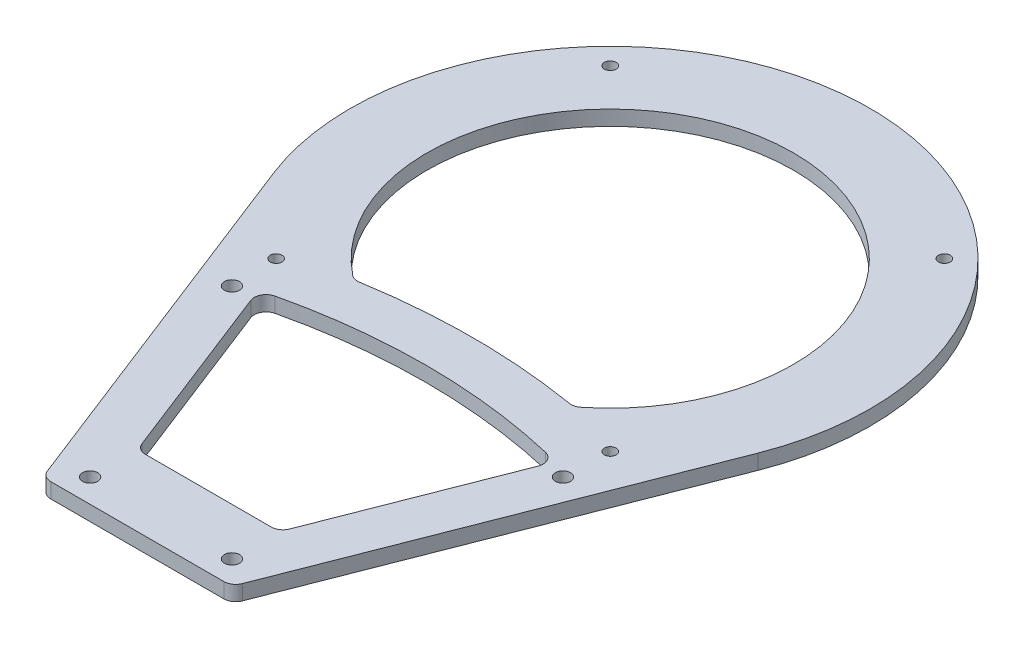
from build123d import *

# Parameters (mm, degrees)
BOSS_EXTRUDE1_DEPTH         = 6.35
M6_CLEARANCE_HOLE1_D        = 6.4
TAP_DRILL_FOR_M6X1_0_TAP1_D = 5
FILLET1_R                   = 5
FILLET2_R                   = 5


with BuildPart() as part:
    # Sketch1 → Boss-Extrude1 (new body)
    with BuildSketch(Plane(origin=(0, 0, 0), x_dir=(1, 0, 0), z_dir=(0, 1, 0))):
        with BuildLine():
            Line((-102.466925197, -40.006614961), (-40, -200))
            Line((-40, -200), (40, -200))
            Line((40, -200), (102.466925197, -40.006614961))
            ThreePointArc((102.466925197, -40.006614961), (0, 110), (-102.466925197, -40.006614961))
        make_face()
        with BuildLine():
            Line((-30, -170), (30, -170))
            Line((30, -170), (62.79649165, -86))
            ThreePointArc((62.79649165, -86), (0, -77.984711576), (-62.79649165, -86))
            Line((-62.79649165, -86), (-30, -170))
        make_face(mode=Mode.SUBTRACT)
        with BuildLine():
            ThreePointArc((-46.479429348, -62.015422658), (0, -57.984711576), (46.479429348, -62.015422658))
            ThreePointArc((46.479429348, -62.015422658), (0, 77.5), (-46.479429348, -62.015422658))
        make_face(mode=Mode.SUBTRACT)
    extrude(amount=-BOSS_EXTRUDE1_DEPTH)

    # M6 Clearance Hole1 (through all)
    with Locations(Plane(origin=(-70, 0, 90), x_dir=(0, 0, 1), z_dir=(0, 1, 0))):
        with Locations((0, 0), (100, 40), (100, 100), (0, 140)):
            Hole(M6_CLEARANCE_HOLE1_D / 2)

    # Tap Drill for M6x1.0 Tap1 (through all)
    with Locations(Plane(origin=(-70.64375, 0, 70.64375), x_dir=(0, 0, 1), z_dir=(0, 1, 0))):
        with Locations((0, 0), (-141.2875, 0), (-141.2875, 141.2875), (0, 141.2875)):
            Hole(TAP_DRILL_FOR_M6X1_0_TAP1_D / 2)

    # Fillet1
    fillet1_edges = [part.edges().sort_by_distance(p)[0] for p in [
        (-46.479429348, -3.175, 62.015422658),
        (46.479429348, -3.175, 62.015422658),
        (-30, -3.175, 170),
        (-62.79649165, -3.175, 86),
        (62.79649165, -3.175, 86),
        (30, -3.175, 170),
    ]]
    fillet(fillet1_edges, radius=FILLET1_R)

    # Fillet2
    fillet2_edges = [part.edges().sort_by_distance(p)[0] for p in [
        (40, -3.175, 200),
        (-40, -3.175, 200),
    ]]
    fillet(fillet2_edges, radius=FILLET2_R)


solid = part.part
